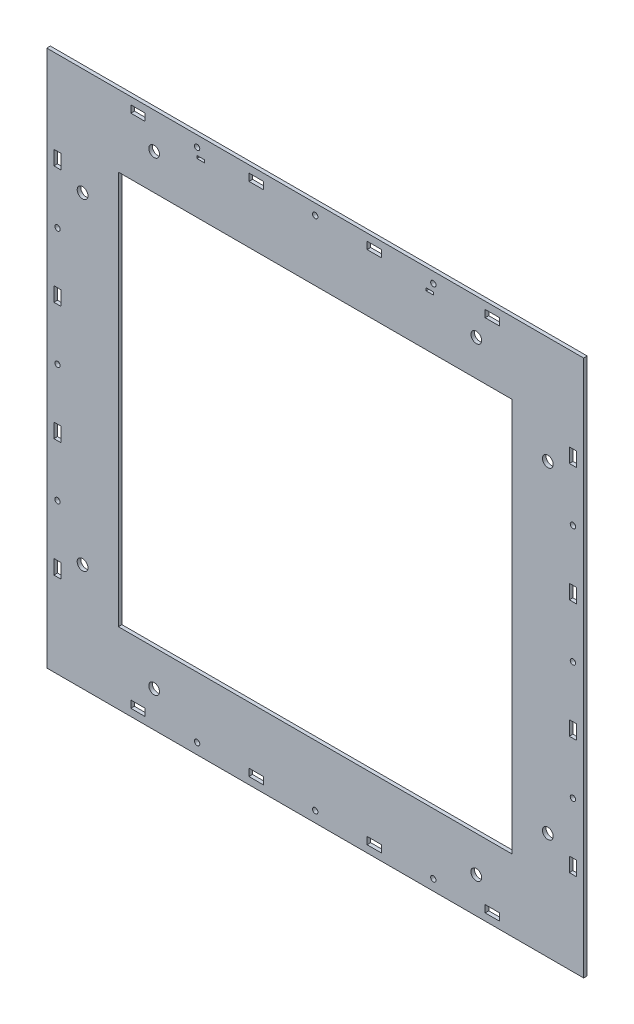
from build123d import *

# Parameters (mm, degrees)
SKETCH_1_W          = 4
SKETCH_1_H          = 1.5
EXTRUDE_1_DEPTH     = 2
SKETCH_3_R          = 1.5
SKETCH_3_R_2        = 1.65
SKETCH_3_W          = 8.03
SKETCH_3_H          = 4.03
SKETCH_3_W_2        = 4.03
SKETCH_3_H_2        = 8.03
CUT_EXTRUDE_2_DEPTH = 4
SKETCH_7_R          = 3
CUT_EXTRUDE_3_DEPTH = 10
SKETCH_8_W          = 220
SKETCH_8_H          = 220
CUT_EXTRUDE_4_DEPTH = 4


with BuildPart() as part:
    # 草图1 → 凸台-拉伸1 (new body)
    with BuildSketch(Plane.XY):
        Polygon((151.457142857, -41.187142857), (151.457142857, 108.812857143), (-148.542857143, 108.812857143), (-148.542857143, -191.187142857), (151.457142857, -191.187142857), align=None)
        with Locations((65.457142857, 98.062857143)):
            Rectangle(SKETCH_1_W, SKETCH_1_H, mode=Mode.SUBTRACT)
        with Locations((-62.542857143, 98.062857143)):
            Rectangle(SKETCH_1_W, SKETCH_1_H, mode=Mode.SUBTRACT)
    extrude(amount=EXTRUDE_1_DEPTH)

    # 草图3 → 切除-拉伸2 (cut)
    with BuildSketch(Plane.XY.offset(2)):
        with Locations((1.457142857, -185.187142857)):
            Circle(SKETCH_3_R)
        with Locations((67.457142857, -185.187142857)):
            Circle(SKETCH_3_R)
        with Locations((-64.542857143, -185.187142857)):
            Circle(SKETCH_3_R)
        with Locations((-142.542857143, 24.812857143)):
            Circle(SKETCH_3_R)
        with Locations((-142.542857143, -41.187142857)):
            Circle(SKETCH_3_R)
        with Locations((-142.542857143, -107.187142857)):
            Circle(SKETCH_3_R)
        with Locations((67.457142857, 102.812857143)):
            Circle(SKETCH_3_R)
        with Locations((1.457142857, 102.812857143)):
            Circle(SKETCH_3_R)
        with Locations((-64.542857143, 102.812857143)):
            Circle(SKETCH_3_R)
        with Locations((145.457142857, -107.187142857)):
            Circle(SKETCH_3_R)
        with Locations((145.457142857, -41.187142857)):
            Circle(SKETCH_3_R)
        with Locations((145.457142857, 24.812857143)):
            Circle(SKETCH_3_R)
        with Locations((1.457142857, -108.687142857)):
            Circle(SKETCH_3_R_2)
        with Locations((-46.272564873, -88.916850587)):
            Circle(SKETCH_3_R_2)
        with Locations((-66.042857143, -41.187142857)):
            Circle(SKETCH_3_R_2)
        with Locations((-46.272564873, 6.542564873)):
            Circle(SKETCH_3_R_2)
        with Locations((1.457142857, 26.312857143)):
            Circle(SKETCH_3_R_2)
        with Locations((49.186850587, 6.542564873)):
            Circle(SKETCH_3_R_2)
        with Locations((68.957142857, -41.187142857)):
            Circle(SKETCH_3_R_2)
        with Locations((49.186850587, -88.916850587)):
            Circle(SKETCH_3_R_2)
        with Locations((1.457142857, -125.187142857)):
            Circle(SKETCH_3_R)
        with Locations((100.457142857, -185.187142857)):
            Rectangle(SKETCH_3_W, SKETCH_3_H)
        with Locations((34.457142857, -185.187142857)):
            Rectangle(SKETCH_3_W, SKETCH_3_H)
        with Locations((-31.542857143, -185.187142857)):
            Rectangle(SKETCH_3_W, SKETCH_3_H)
        with Locations((-97.542857143, -185.187142857)):
            Rectangle(SKETCH_3_W, SKETCH_3_H)
        with Locations((-142.542857143, 57.812857143)):
            Rectangle(SKETCH_3_W_2, SKETCH_3_H_2)
        with Locations((-142.542857143, -8.187142857)):
            Rectangle(SKETCH_3_W_2, SKETCH_3_H_2)
        with Locations((-142.542857143, -74.187142857)):
            Rectangle(SKETCH_3_W_2, SKETCH_3_H_2)
        with Locations((-142.542857143, -140.187142857)):
            Rectangle(SKETCH_3_W_2, SKETCH_3_H_2)
        with Locations((100.457142857, 102.812857143)):
            Rectangle(SKETCH_3_W, SKETCH_3_H)
        with Locations((34.457142857, 102.812857143)):
            Rectangle(SKETCH_3_W, SKETCH_3_H)
        with Locations((-31.542857143, 102.812857143)):
            Rectangle(SKETCH_3_W, SKETCH_3_H)
        with Locations((-97.542857143, 102.812857143)):
            Rectangle(SKETCH_3_W, SKETCH_3_H)
        with Locations((145.457142857, -140.187142857)):
            Rectangle(SKETCH_3_W_2, SKETCH_3_H_2)
        with Locations((145.457142857, -74.187142857)):
            Rectangle(SKETCH_3_W_2, SKETCH_3_H_2)
        with Locations((145.457142857, -8.187142857)):
            Rectangle(SKETCH_3_W_2, SKETCH_3_H_2)
        with Locations((145.457142857, 57.812857143)):
            Rectangle(SKETCH_3_W_2, SKETCH_3_H_2)
    extrude(amount=-CUT_EXTRUDE_2_DEPTH, mode=Mode.SUBTRACT)

    # 草图7 → 切除-拉伸3 (cut)
    with BuildSketch(Plane.XY.offset(2)):
        with Locations((-88.542857143, -171.187142857)):
            Circle(SKETCH_7_R)
        with Locations((91.457142857, -171.187142857)):
            Circle(SKETCH_7_R)
        with Locations((-128.542857143, 48.812857143)):
            Circle(SKETCH_7_R)
        with Locations((-128.542857143, -131.187142857)):
            Circle(SKETCH_7_R)
        with Locations((91.457142857, 88.812857143)):
            Circle(SKETCH_7_R)
        with Locations((-88.542857143, 88.812857143)):
            Circle(SKETCH_7_R)
        with Locations((131.457142857, -131.187142857)):
            Circle(SKETCH_7_R)
        with Locations((131.457142857, 48.812857143)):
            Circle(SKETCH_7_R)
    extrude(amount=-CUT_EXTRUDE_3_DEPTH, mode=Mode.SUBTRACT)

    # 草图8 → 切除-拉伸4 (cut)
    with BuildSketch(Plane.XY.offset(2)):
        with Locations((1.457142857, -41.187142857)):
            Rectangle(SKETCH_8_W, SKETCH_8_H)
    extrude(amount=-CUT_EXTRUDE_4_DEPTH, mode=Mode.SUBTRACT)


solid = part.part
